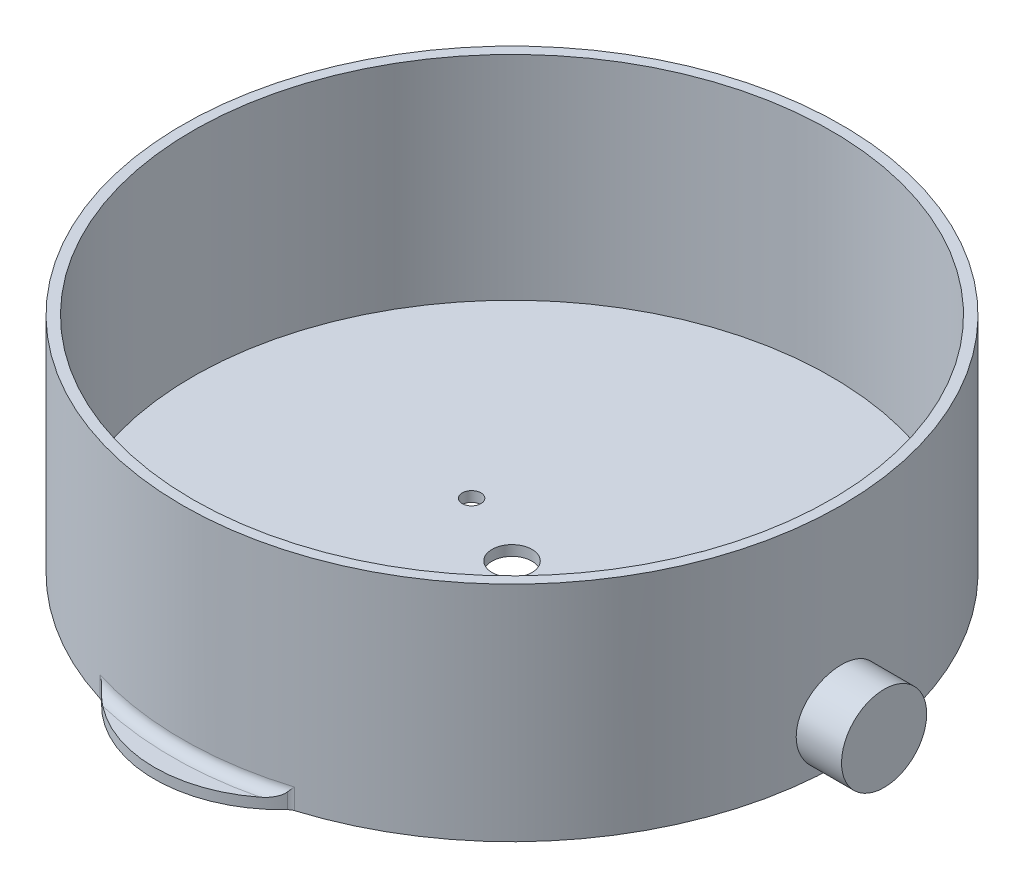
from build123d import *

# Parameters (mm, degrees)
SKETCH1_R           = 75
BOSS_EXTRUDE1_DEPTH = 50
SHELL1_T            = 2.4
SKETCH2_R           = 21
SKETCH2_R_2         = 1.75
CUT_EXTRUDE1_DEPTH  = 121.3391873
BOSS_EXTRUDE3_START = -2.4
BOSS_EXTRUDE3_DEPTH = 2.4
FILLET1_R           = 2.4
SKETCH5_R           = 10
BOSS_EXTRUDE5_DEPTH = 12.4
SKETCH6_R           = 4.7
SKETCH6_R_2         = 2.2
CUT_EXTRUDE2_DEPTH  = 132.12879182


with BuildPart() as part:
    # Sketch1 → Boss-Extrude1 (new body)
    with BuildSketch(Plane(origin=(0, 0, 0), x_dir=(1, 0, 0), z_dir=(0, 1, 0))):
        with Locations(Location((0, 0, 0), (0, 0, 270))):
            Circle(SKETCH1_R)
    extrude(amount=BOSS_EXTRUDE1_DEPTH)

    # Shell1
    shell1_openings = [part.faces().sort_by_distance(p)[0] for p in [
        (0, 50, 0),
    ]]
    offset(amount=SHELL1_T, openings=shell1_openings, kind=Kind.INTERSECTION)

    # Sketch2 → Cut-Extrude1 (cut, through all)
    with BuildSketch(Plane(origin=(0, 0, 0), x_dir=(1, 0, 0), z_dir=(0, 1, 0))):
        with Locations(Location((0, -54, 0), (0, 0, 270))):
            Circle(SKETCH2_R)
        with Locations(Location((0, -27.5, 0), (0, 0, 270))):
            Circle(SKETCH2_R_2)
        with Locations(Location((22.9496732, -67.25, 0), (0, 0, 270))):
            Circle(SKETCH2_R_2)
        with Locations(Location((-22.9496732, -67.25, 0), (0, 0, 270))):
            Circle(SKETCH2_R_2)
    extrude(amount=-CUT_EXTRUDE1_DEPTH, mode=Mode.SUBTRACT)

    # Sketch3 → Boss-Extrude3 (add)
    with BuildSketch(Plane(origin=(0, 0, 0), x_dir=(1, 0, 0), z_dir=(0, 1, 0)).offset(BOSS_EXTRUDE3_START)):
        with BuildLine():
            ThreePointArc((-24.888501361, -70.75), (0, -84), (24.888501361, -70.75))
            ThreePointArc((24.888501361, -70.75), (0, -75), (-24.888501361, -70.75))
        make_face()
    extrude(amount=BOSS_EXTRUDE3_DEPTH)

    # Fillet1
    fillet1_edges = [part.edges().sort_by_distance(p)[0] for p in [
        (-22.237685481, -1.2, 74.136666667),
        (22.237685481, -1.2, 74.136666667),
        (11.237926855, 0, 76.579821102),
    ]]
    fillet(fillet1_edges, radius=FILLET1_R)

    # Sketch5 → Boss-Extrude5 (add)
    with BuildSketch(Plane(origin=(75, 0, 0), x_dir=(0, 0, -1), z_dir=(1, 0, 0))):
        with Locations(Location((0, 7.6, 0), (0, 0, 270))):
            Circle(SKETCH5_R)
    boss_extrude5 = extrude(amount=BOSS_EXTRUDE5_DEPTH)

    # Mirror1: Boss-Extrude5 across plane
    add(boss_extrude5.mirror(Plane(origin=(0, 0, 0), x_dir=(0, 0, 1), z_dir=(1, 0, 0))))

    # Sketch6 → Cut-Extrude2 (cut, through all)
    with BuildSketch(Plane(origin=(0, 0, 0), x_dir=(1, 0, 0), z_dir=(0, 1, 0))):
        with Locations(Location((0, 0, 0), (0, 0, 270))):
            Circle(SKETCH6_R)
        with Locations(Location((17.5, 8, 0), (0, 0, 270))):
            Circle(SKETCH6_R_2)
        with Locations(Location((-17.5, 8, 0), (0, 0, 90))):
            Circle(SKETCH6_R_2)
    extrude(amount=-CUT_EXTRUDE2_DEPTH, mode=Mode.SUBTRACT)


solid = part.part
